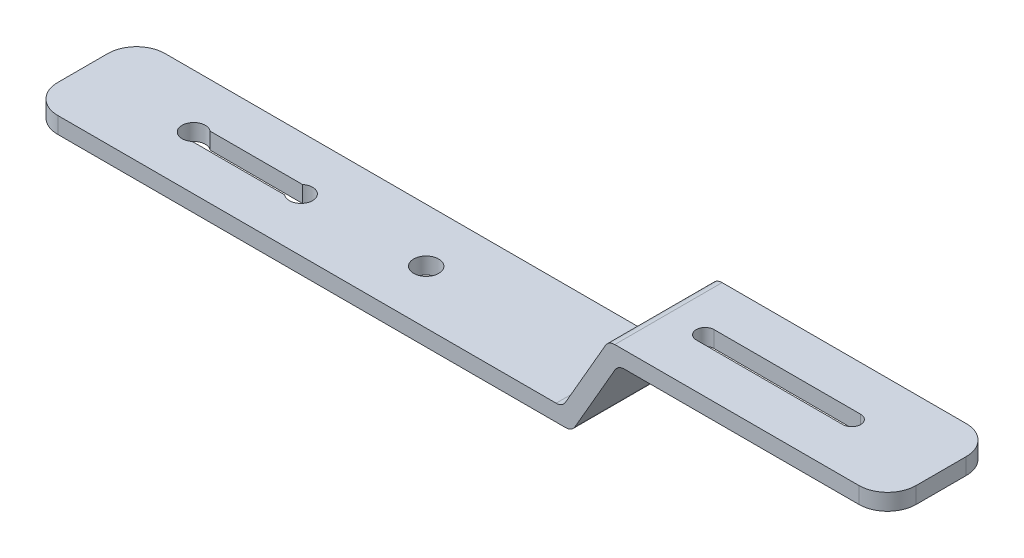
from build123d import *

# Parameters (mm, degrees)
EXTRUDE_1_DEPTH     = 15
CUT_EXTRUDE_1_DEPTH = 242.509337294
FILLET_1_R          = 8
SKETCH_4_R          = 3.5
CUT_EXTRUDE_2_DEPTH = 242.509337294
CUT_EXTRUDE_3_DEPTH = 242.979337961
FILLET_2_R          = 8


with BuildPart() as part:
    # 草圖2 → 填料-伸長1 (new, symmetric)
    with BuildSketch(Plane.XY):
        with BuildLine():
            Line((159.381107666, 13.248555109), (152.598076211, 1.5))
            ThreePointArc((152.598076211, 1.5), (151.5, 0.401923789), (150, 0))
            Line((150, 0), (0, 0))
            Line((0, 0), (0, 4.6))
            Line((0, 4.6), (147.344188762, 4.6))
            ThreePointArc((147.344188762, 4.6), (148.844188762, 5.001923789), (149.942264973, 6.1))
            Line((149.942264973, 6.1), (155.397390809, 15.548555109))
            Line((155.397390809, 15.548555109), (161.142860195, 25.5))
            ThreePointArc((161.142860195, 25.5), (162.240936407, 26.598076211), (163.740936407, 27))
            Line((163.740936407, 27), (240, 27))
            Line((240, 27), (240, 22.4))
            Line((240, 22.4), (166.396747645, 22.4))
            ThreePointArc((166.396747645, 22.4), (164.896747645, 21.998076211), (163.798671434, 20.9))
            Line((163.798671434, 20.9), (159.381107666, 13.248555109))
        make_face()
    extrude(amount=EXTRUDE_1_DEPTH, both=True)

    # 草圖3 → 除料-伸長1 (cut, through all)
    with BuildSketch(Plane(origin=(0, 4.6, 0), x_dir=(1, 0, 0), z_dir=(0, 1, 0))):
        with BuildLine():
            Line((33.076655966, 2.5), (58.923344034, 2.5))
            ThreePointArc((58.923344034, 2.5), (64.25, 0), (58.923344034, -2.5))
            Line((58.923344034, -2.5), (33.076655966, -2.5))
            ThreePointArc((33.076655966, -2.5), (27.75, 0), (33.076655966, 2.5))
        make_face()
    extrude(amount=-CUT_EXTRUDE_1_DEPTH, mode=Mode.SUBTRACT)

    # 圓角1
    fillet_1_edges = [part.edges().sort_by_distance(p)[0] for p in [
        (240, 24.7, -15),
        (240, 24.7, 15),
    ]]
    fillet(fillet_1_edges, radius=FILLET_1_R)

    # 草圖4 → 除料-伸長2 (cut, through all)
    with BuildSketch(Plane(origin=(0, 4.6, 0), x_dir=(1, 0, 0), z_dir=(0, 1, 0))):
        with Locations(Location((96, 0, 0), (0, 0, 180))):
            Circle(SKETCH_4_R)
    extrude(amount=-CUT_EXTRUDE_2_DEPTH, mode=Mode.SUBTRACT)

    # 草圖5 → 除料-伸長3 (cut, through all)
    with BuildSketch(Plane(origin=(0, 27, 0), x_dir=(1, 0, 0), z_dir=(0, 1, 0))):
        with BuildLine():
            Line((174, -2.5), (215, -2.5))
            ThreePointArc((215, -2.5), (217.5, 0), (215, 2.5))
            Line((215, 2.5), (174, 2.5))
            ThreePointArc((174, 2.5), (171.5, 0), (174, -2.5))
        make_face()
    extrude(amount=-CUT_EXTRUDE_3_DEPTH, mode=Mode.SUBTRACT)

    # 圓角2
    fillet_2_edges = [part.edges().sort_by_distance(p)[0] for p in [
        (0, 2.3, -15),
        (0, 2.3, 15),
    ]]
    fillet(fillet_2_edges, radius=FILLET_2_R)


solid = part.part
